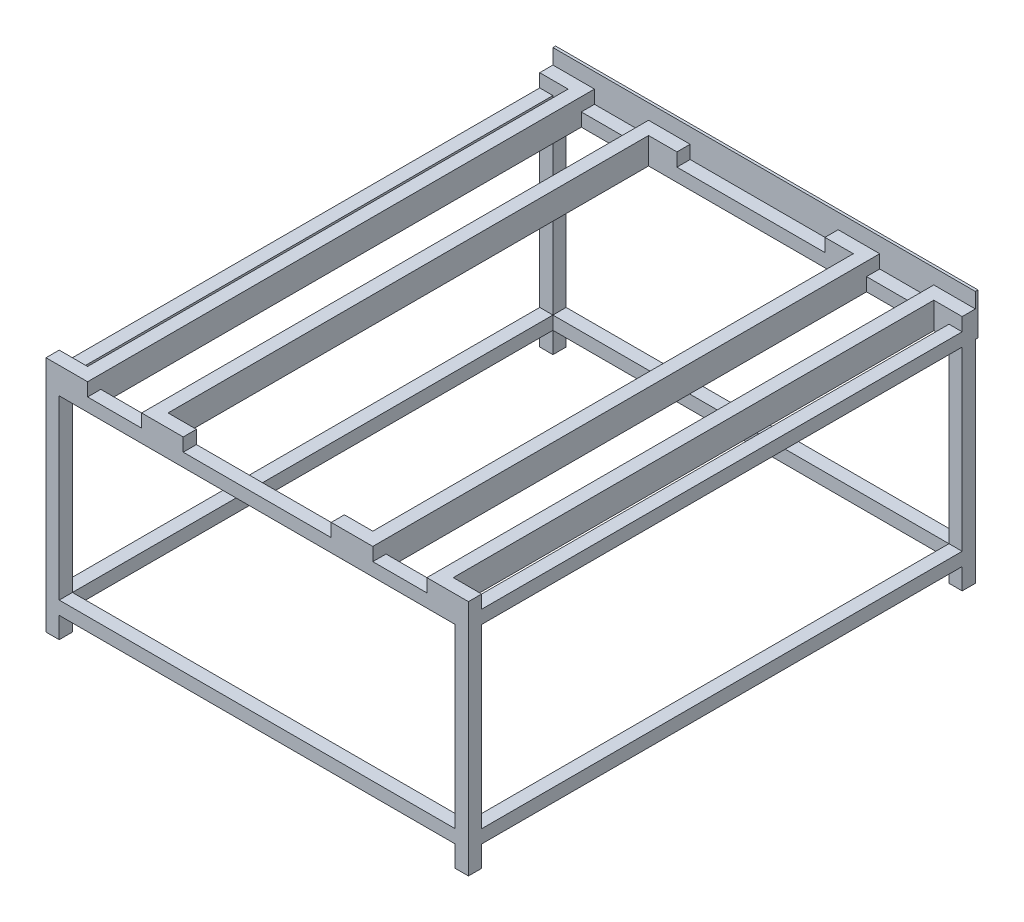
from build123d import *

# Parameters (mm, degrees)
SKETCH2_W             = 31.75
SKETCH2_H             = 31.75
BOSS_EXTRUDE1_DEPTH   = 508
BOSS_EXTRUDE1_2_DEPTH = 508
BOSS_EXTRUDE1_3_DEPTH = 508
BOSS_EXTRUDE1_4_DEPTH = 508
SKETCH3_W             = 1016
SKETCH3_H             = 1219.2
SKETCH3_W_2           = 952.5
SKETCH3_H_2           = 1155.7
BOSS_EXTRUDE2_DEPTH   = 31.75
BOSS_EXTRUDE3_START   = -457.2
SKETCH3_2_W           = 1016
SKETCH3_2_H           = 1219.2
SKETCH3_2_W_2         = 952.5
SKETCH3_2_H_2         = 1155.7
BOSS_EXTRUDE3_DEPTH   = 31.75
SKETCH4_W             = 100
SKETCH4_H             = 31.75
BOSS_EXTRUDE4_DEPTH   = 31.75
SKETCH5_W             = 31.75
SKETCH5_H             = 63.5
BOSS_EXTRUDE5_DEPTH   = 1155.7
SKETCH6_W             = 1016
SKETCH6_H             = 100
BOSS_EXTRUDE6_DEPTH   = 6.35


with BuildPart() as part:
    # Sketch2 → Boss-Extrude1 (new body)
    with BuildSketch(Plane(origin=(0, 0, 0), x_dir=(1, 0, 0), z_dir=(0, 1, 0))):
        with Locations((15.875, 1203.325)):
            Rectangle(SKETCH2_W, SKETCH2_H)
    extrude(amount=BOSS_EXTRUDE1_DEPTH)



with BuildPart() as body_2:
    # Sketch2 → Boss-Extrude1 2 (new body)
    with BuildSketch(Plane(origin=(0, 0, 0), x_dir=(1, 0, 0), z_dir=(0, 1, 0))):
        with Locations((15.875, 15.875)):
            Rectangle(SKETCH2_W, SKETCH2_H)
    extrude(amount=BOSS_EXTRUDE1_2_DEPTH)


with BuildPart() as body_3:
    # Sketch2 → Boss-Extrude1 3 (new body)
    with BuildSketch(Plane(origin=(0, 0, 0), x_dir=(1, 0, 0), z_dir=(0, 1, 0))):
        with Locations((1000.125, 15.875)):
            Rectangle(SKETCH2_W, SKETCH2_H)
    extrude(amount=BOSS_EXTRUDE1_3_DEPTH)


with BuildPart() as body_4:
    # Sketch2 → Boss-Extrude1 4 (new body)
    with BuildSketch(Plane(origin=(0, 0, 0), x_dir=(1, 0, 0), z_dir=(0, 1, 0))):
        with Locations((1000.125, 1203.325)):
            Rectangle(SKETCH2_W, SKETCH2_H)
    extrude(amount=BOSS_EXTRUDE1_4_DEPTH)


with BuildPart() as part_1:
    add(part.part)

    add(body_2.part)  # Boss-Extrude2 merges body 2

    add(body_3.part)  # Boss-Extrude2 merges body 3

    add(body_4.part)  # Boss-Extrude2 merges body 4
    # Sketch3 → Boss-Extrude2 (add)
    with BuildSketch(Plane(origin=(0, 508, 0), x_dir=(1, 0, 0), z_dir=(0, 1, 0))):
        with Locations((508, 609.6)):
            Rectangle(SKETCH3_W, SKETCH3_H)
        with Locations((508, 609.6)):
            Rectangle(SKETCH3_W_2, SKETCH3_H_2, mode=Mode.SUBTRACT)
    extrude(amount=BOSS_EXTRUDE2_DEPTH)

    # Sketch3<2> → Boss-Extrude3 (add)
    with BuildSketch(Plane(origin=(0, 508, 0), x_dir=(1, 0, 0), z_dir=(0, 1, 0)).offset(BOSS_EXTRUDE3_START)):
        with Locations((508, 609.6)):
            Rectangle(SKETCH3_2_W, SKETCH3_2_H)
        with Locations((508, 609.6)):
            Rectangle(SKETCH3_2_W_2, SKETCH3_2_H_2, mode=Mode.SUBTRACT)
    extrude(amount=BOSS_EXTRUDE3_DEPTH)

    # Sketch4 → Boss-Extrude4 (add)
    with BuildSketch(Plane(origin=(0, 539.75, 0), x_dir=(1, 0, 0), z_dir=(0, 1, 0))):
        with Locations((50, 1203.325)):
            Rectangle(SKETCH4_W, SKETCH4_H)
        with Locations((280, 1203.325)):
            Rectangle(SKETCH4_W, SKETCH4_H)
        with Locations((966, 1203.325)):
            Rectangle(SKETCH4_W, SKETCH4_H)
        with Locations((736, 1203.325)):
            Rectangle(SKETCH4_W, SKETCH4_H)
        with Locations((736, 15.875)):
            Rectangle(SKETCH4_W, SKETCH4_H)
        with Locations((966, 15.875)):
            Rectangle(SKETCH4_W, SKETCH4_H)
        with Locations((280, 15.875)):
            Rectangle(SKETCH4_W, SKETCH4_H)
        with Locations((50, 15.875)):
            Rectangle(SKETCH4_W, SKETCH4_H)
    extrude(amount=BOSS_EXTRUDE4_DEPTH)

    # Sketch5 → Boss-Extrude5 (add)
    with BuildSketch(Plane.XY.offset(-1187.45)):
        with Locations((84.125, 539.75)):
            Rectangle(SKETCH5_W, SKETCH5_H)
        with Locations((245.875, 539.75)):
            Rectangle(SKETCH5_W, SKETCH5_H)
        with Locations((770.125, 539.75)):
            Rectangle(SKETCH5_W, SKETCH5_H)
        with Locations((931.875, 539.75)):
            Rectangle(SKETCH5_W, SKETCH5_H)
    extrude(amount=BOSS_EXTRUDE5_DEPTH)

    # Sketch6 → Boss-Extrude6 (add)
    with BuildSketch(Plane(origin=(0, 0, -1219.2), x_dir=(-1, 0, 0), z_dir=(0, 0, -1))):
        with Locations((-508, 558)):
            Rectangle(SKETCH6_W, SKETCH6_H)
    extrude(amount=BOSS_EXTRUDE6_DEPTH)


solid = part_1.part
